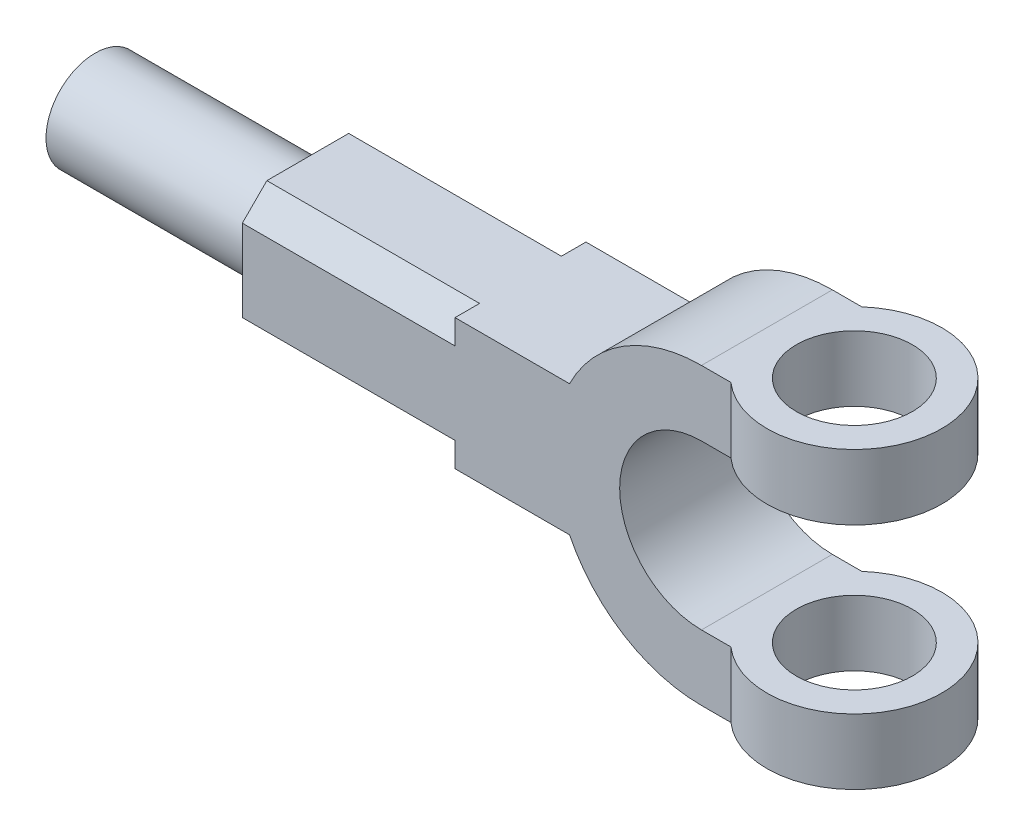
from build123d import *

# Parameters (mm, degrees)
BOSS_EXTRUDE1_DEPTH = 20
SKETCH2_R           = 26.722222222
SKETCH2_R_2         = 17.722222222
BOSS_EXTRUDE2_DEPTH = 20
CUT_EXTRUDE1_DEPTH  = 65
SKETCH4_R           = 15
BOSS_EXTRUDE3_DEPTH = 65
CIRPATTERN1_COUNT   = 4


with BuildPart() as part:
    # Sketch1 → Boss-Extrude1 (new, symmetric)
    with BuildSketch(Plane.XY):
        with BuildLine():
            Line((-140.311288741, 0), (-45, 0))
            ThreePointArc((-45, 0), (-43.812144397, 10.271124735), (-40.311288741, 20))
            Line((-40.311288741, 20), (-140.311288741, 20))
            Line((-140.311288741, 20), (-140.311288741, 0))
        make_face()
        with BuildLine():
            ThreePointArc((-40.311288741, -20), (-43.812144397, -10.271124735), (-45, 0))
            Line((-45, 0), (-140.311288741, 0))
            Line((-140.311288741, 0), (-140.311288741, -20))
            Line((-140.311288741, -20), (-40.311288741, -20))
        make_face()
        with BuildLine():
            ThreePointArc((-25, 0), (-17.67766953, 17.67766953), (0, 25))
            Line((0, 25), (9, 25))
            Line((9, 25), (9, 45))
            Line((9, 45), (0, 45))
            ThreePointArc((0, 45), (-23.717082451, 38.242646352), (-40.311288741, 20))
            ThreePointArc((-40.311288741, 20), (-43.812144397, 10.271124735), (-45, 0))
            Line((-45, 0), (-25, 0))
        make_face()
        with BuildLine():
            ThreePointArc((0, -25), (-17.67766953, -17.67766953), (-25, 0))
            Line((-25, 0), (-45, 0))
            ThreePointArc((-45, 0), (-43.812144397, -10.271124735), (-40.311288741, -20))
            ThreePointArc((-40.311288741, -20), (-23.717082451, -38.242646352), (0, -45))
            Line((0, -45), (9, -45))
            Line((9, -45), (9, -25))
            Line((9, -25), (0, -25))
        make_face()
    extrude(amount=BOSS_EXTRUDE1_DEPTH, both=True)

    # Sketch2 → Boss-Extrude2 (add)
    with BuildSketch(Plane(origin=(0, 45, 0), x_dir=(1, 0, 0), z_dir=(0, 1, 0))):
        with Locations((26.722222222, 0)):
            Circle(SKETCH2_R)
        with Locations(Location((26.722222222, 0, 0), (0, 0, 270))):
            Circle(SKETCH2_R_2, mode=Mode.SUBTRACT)
    boss_extrude2 = extrude(amount=-BOSS_EXTRUDE2_DEPTH)

    # Mirror1: Boss-Extrude2 across plane
    add(boss_extrude2.mirror(Plane.ZX))

    # Sketch3 → Cut-Extrude1 (cut)
    with BuildSketch(Plane.ZY.offset(140.311288741)):
        Polygon((-12.5, 20), (-20, 20), (-20, 12.5), align=None)
    cut_extrude1 = extrude(amount=-CUT_EXTRUDE1_DEPTH, mode=Mode.SUBTRACT)

    # Sketch4 → Boss-Extrude3 (add)
    with BuildSketch(Plane.ZY.offset(140.311288741)):
        with Locations(Location((0, 0, 0), (0, 0, 180))):
            Circle(SKETCH4_R)
    extrude(amount=BOSS_EXTRUDE3_DEPTH)

    # CirPattern1: Cut-Extrude1 ×4 about axis
    cirpattern1_axis = Axis((0, 0, 0), (1, 0, 0))
    for i in range(1, CIRPATTERN1_COUNT):
        add(cut_extrude1.rotate(cirpattern1_axis, i * 360 / CIRPATTERN1_COUNT), mode=Mode.SUBTRACT)


solid = part.part
